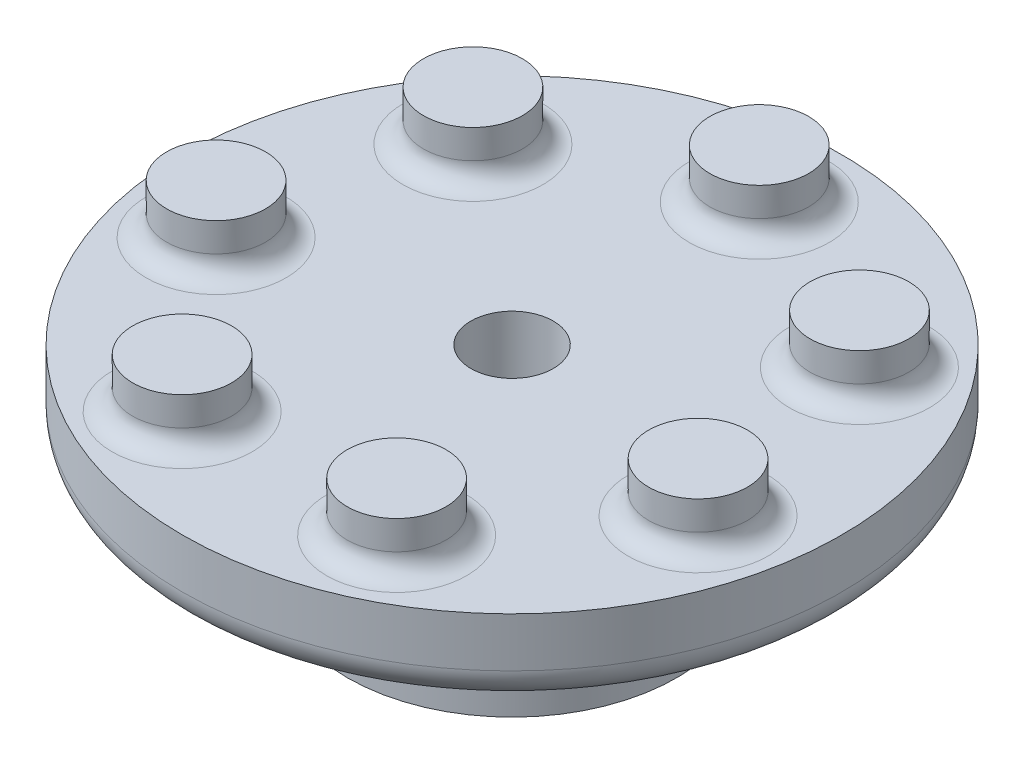
from build123d import *

# Parameters (mm, degrees)
SKETCH1_R                = 25.4
BOSS_EXTRUDE1_DEPTH      = 6.35
SKETCH4_R                = 3.175
CUT_EXTRUDE2_DEPTH       = 6.35
SKETCH2_R                = 3.81
BOSS_EXTRUDE3_DEPTH      = 3.81
FILLET2_R                = 1.5875
CIRPATTERN1_COUNT        = 7
FILLET2_OF_CIRPATTERN1_R = 1.5875
FILLET1_R                = 2.54
SCALE1_SCALE             = 2
SCALE2_SCALE             = 2
SCALE3_SCALE             = 0.5
SCALE4_SCALE             = 0.5
BOSS_EXTRUDE4_START      = 9.525
SKETCH5_R                = 12.7
SKETCH5_R_2              = 3.175
BOSS_EXTRUDE4_DEPTH      = 9.525
SKETCH6_R                = 2.159
CUT_EXTRUDE3_DEPTH       = 6.35
CIRPATTERN2_COUNT        = 4


with BuildPart() as part:
    # Sketch1 → Boss-Extrude1 (new body)
    with BuildSketch(Plane(origin=(0, 0, 0), x_dir=(1, 0, 0), z_dir=(0, 1, 0))):
        with Locations(Location((0, 0, 0), (0, 0, 270))):
            Circle(SKETCH1_R)
    extrude(amount=BOSS_EXTRUDE1_DEPTH)

    # Sketch4 → Cut-Extrude2 (cut)
    with BuildSketch(Plane.XZ):
        with Locations(Location((0, 0, 0), (0, 0, 270))):
            Circle(SKETCH4_R)
    extrude(amount=-CUT_EXTRUDE2_DEPTH, mode=Mode.SUBTRACT)

    # Sketch2 → Boss-Extrude3 (add)
    with BuildSketch(Plane(origin=(0, 6.35, 0), x_dir=(1, 0, 0), z_dir=(0, 1, 0))):
        with Locations(Location((0, 19.05, 0), (0, 0, 90))):
            Circle(SKETCH2_R)
    boss_extrude3 = extrude(amount=BOSS_EXTRUDE3_DEPTH)

    # Fillet2
    fillet2_edges = [part.edges().sort_by_distance(p)[0] for p in [
        (0, 6.35, -15.24),
    ]]
    fillet(fillet2_edges, radius=FILLET2_R)

    # CirPattern1: Boss-Extrude3 ×7 about axis
    cirpattern1_axis = Axis((0, 0, 0), (0, 1, 0))
    for i in range(1, CIRPATTERN1_COUNT):
        add(boss_extrude3.rotate(cirpattern1_axis, i * 360 / CIRPATTERN1_COUNT))

    # Fillet2 of CirPattern1
    fillet2_of_cirpattern1_edges = [part.edges().sort_by_distance(p)[0] for p in [
        (-11.915111793, 6.35, -9.50198458),
        (-14.857901382, 6.35, 3.391219033),
        (-6.612388184, 6.35, 13.730765547),
        (6.612388184, 6.35, 13.730765547),
        (14.857901382, 6.35, 3.391219033),
        (11.915111793, 6.35, -9.50198458),
    ]]
    fillet(fillet2_of_cirpattern1_edges, radius=FILLET2_OF_CIRPATTERN1_R)

    # Fillet1
    fillet1_edges = [part.edges().sort_by_distance(p)[0] for p in [
        (0, 0, -25.4),
    ]]
    fillet(fillet1_edges, radius=FILLET1_R)


with BuildPart() as part_1:
    # Scale1: scaled about (0, 3.689877277, 0)
    add(part.part.scale(SCALE1_SCALE).moved(Location((0, -3.689877277, 0))))


with BuildPart() as part_2:
    # Scale2: scaled about (0, 3.689877276, 0)
    add(part_1.part.scale(SCALE2_SCALE).moved(Location((0, -3.689877276, 0))))


with BuildPart() as part_3:
    # Scale3: scaled about (0, 3.689877276, 0)
    add(part_2.part.scale(SCALE3_SCALE).moved(Location((0, 1.844938638, 0))))


with BuildPart() as part_4:
    # Scale4: scaled about (0, 3.689877276, 0)
    add(part_3.part.scale(SCALE4_SCALE).moved(Location((0, 1.844938638, 0))))

    # Sketch5 → Boss-Extrude4 (add)
    with BuildSketch(Plane.XZ.offset(BOSS_EXTRUDE4_START)):
        with Locations(Location((0, 0, 0), (0, 0, 90))):
            Circle(SKETCH5_R)
        with Locations(Location((0, 0, 0), (0, 0, 270))):
            Circle(SKETCH5_R_2, mode=Mode.SUBTRACT)
    extrude(amount=-BOSS_EXTRUDE4_DEPTH)

    # Sketch6 → Cut-Extrude3 (cut)
    with BuildSketch(Plane.XZ.offset(9.525)):
        with Locations(Location((-2.291996867, -7.599385279, 0), (0, 0, 270))):
            Circle(SKETCH6_R)
    cut_extrude3 = extrude(amount=-CUT_EXTRUDE3_DEPTH, mode=Mode.SUBTRACT)

    # CirPattern2: Cut-Extrude3 ×4 about axis
    cirpattern2_axis = Axis((0, 0, 0), (0, 1, 0))
    for i in range(1, CIRPATTERN2_COUNT):
        add(cut_extrude3.rotate(cirpattern2_axis, i * 360 / CIRPATTERN2_COUNT), mode=Mode.SUBTRACT)


solid = part_4.part
